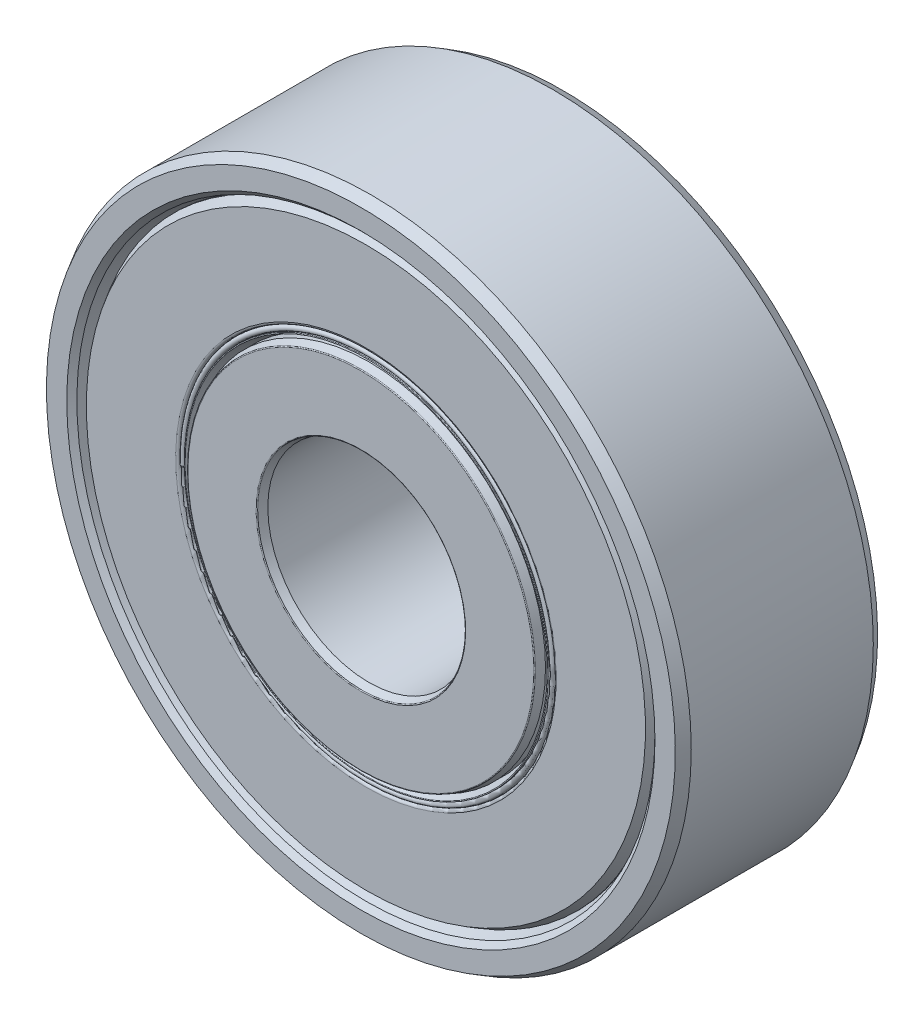
from build123d import *

# Parameters (mm, degrees)
CIRPATTERN1_COUNT = 6


with BuildPart() as part:
    # Sketch3 → Revolve1 (revolve)
    with BuildSketch(Plane(origin=(0, 0, 0), x_dir=(0, 0, -1), z_dir=(1, 0, 0)), mode=Mode.PRIVATE) as revolve1_sk:
        with BuildLine():
            Line((-2.524480927, 8.455), (-2.85, 8.573479253))
            Line((-2.85, 8.573479253), (-3, 8.723479253))
            Line((-3, 8.723479253), (-3, 9.326794919))
            Line((-3, 9.326794919), (-2.7, 9.5))
            Line((-2.7, 9.5), (2.7, 9.5))
            Line((2.7, 9.5), (3, 9.326794919))
            Line((3, 9.326794919), (3, 8.723479253))
            Line((3, 8.723479253), (2.85, 8.573479253))
            Line((2.85, 8.573479253), (2.524480927, 8.455))
            Line((2.524480927, 8.455), (1.398, 8.455))
            ThreePointArc((1.398, 8.455), (0, 8.9775), (-1.398, 8.455))
            Line((-1.398, 8.455), (-2.524480927, 8.455))
        make_face()
    revolve(revolve1_sk.sketch.rotate(Axis((0, 0, 3), (0, 0, -1)), 180), axis=Axis((0, 0, 3), (0, 0, -1)))


with BuildPart() as body_2:
    # Sketch4 → Revolve2 (revolve)
    with BuildSketch(Plane(origin=(0, 0, 0), x_dir=(0, 0, -1), z_dir=(1, 0, 0)), mode=Mode.PRIVATE) as revolve2_sk:
        with BuildLine():
            Line((-2.76, 3), (-2.980260604, 3.080168304))
            ThreePointArc((-2.980260604, 3.080168304), (-2.994574561, 3.091151789), (-3, 3.108359082))
            Line((-3, 3.108359082), (-3, 5.128654793))
            ThreePointArc((-3, 5.128654793), (-2.994574561, 5.145862086), (-2.980260604, 5.156845572))
            Line((-2.980260604, 5.156845572), (-2.76, 5.237013876))
            Line((-2.76, 5.237013876), (-1.398, 5.237013876))
            ThreePointArc((-1.398, 5.237013876), (0, 4.714513876), (1.398, 5.237013876))
            Line((1.398, 5.237013876), (2.76, 5.237013876))
            Line((2.76, 5.237013876), (2.980260604, 5.156845572))
            ThreePointArc((2.980260604, 5.156845572), (2.994574561, 5.145862086), (3, 5.128654793))
            Line((3, 5.128654793), (3, 3.108359082))
            ThreePointArc((3, 3.108359082), (2.994574561, 3.091151789), (2.980260604, 3.080168304))
            Line((2.980260604, 3.080168304), (2.76, 3))
            Line((2.76, 3), (-2.76, 3))
        make_face()
    revolve(revolve2_sk.sketch.rotate(Axis((0, 0, 3), (0, 0, -1)), 180), axis=Axis((0, 0, 3), (0, 0, -1)))


with BuildPart() as body_3:
    # Sketch5 → Revolve3 (revolve)
    with BuildSketch(Plane(origin=(0, 0, 0), x_dir=(0, 0, -1), z_dir=(1, 0, 0))):
        with BuildLine():
            Line((-2.131493062, 6.846006938), (2.131493062, 6.846006938))
            ThreePointArc((2.131493062, 6.846006938), (0, 8.9775), (-2.131493062, 6.846006938))
        make_face()
    revolve(axis=Axis((0, 6.846006938, 2.131493062), (0, 0, -1)))


with BuildPart() as cirpattern1_1:
    # CirPattern1: pattern copy
    add(body_3.part.rotate(Axis((0, 0, 0), (0, 0, 1)), 1 * 360 / CIRPATTERN1_COUNT))


with BuildPart() as cirpattern1_2:
    # CirPattern1: pattern copy
    add(body_3.part.rotate(Axis((0, 0, 0), (0, 0, 1)), 2 * 360 / CIRPATTERN1_COUNT))


with BuildPart() as cirpattern1_3:
    # CirPattern1: pattern copy
    add(body_3.part.rotate(Axis((0, 0, 0), (0, 0, 1)), 3 * 360 / CIRPATTERN1_COUNT))


with BuildPart() as cirpattern1_4:
    # CirPattern1: pattern copy
    add(body_3.part.rotate(Axis((0, 0, 0), (0, 0, 1)), 4 * 360 / CIRPATTERN1_COUNT))


with BuildPart() as cirpattern1_5:
    # CirPattern1: pattern copy
    add(body_3.part.rotate(Axis((0, 0, 0), (0, 0, 1)), 5 * 360 / CIRPATTERN1_COUNT))


with BuildPart() as body_9:
    # Sketch6 → Revolve4 (revolve)
    with BuildSketch(Plane(origin=(0, 0, 0), x_dir=(0, 0, -1), z_dir=(1, 0, 0)), mode=Mode.PRIVATE) as revolve4_sk:
        with BuildLine():
            Line((-2.568541744, 8.455), (-2.131493062, 8.455))
            Line((-2.131493062, 8.455), (-2.131493062, 5.562013876))
            Line((-2.131493062, 5.562013876), (-2.76875, 5.562013876))
            ThreePointArc((-2.76875, 5.562013876), (-2.826202426, 5.58581145), (-2.85, 5.643263876))
            Line((-2.85, 5.643263876), (-2.85, 8.2925))
            Line((-2.85, 8.2925), (-2.568541744, 8.455))
        make_face()
        with BuildLine():
            Line((2.76875, 5.562013876), (2.131493062, 5.562013876))
            Line((2.131493062, 5.562013876), (2.131493062, 8.455))
            Line((2.131493062, 8.455), (2.568541744, 8.455))
            Line((2.568541744, 8.455), (2.85, 8.2925))
            Line((2.85, 8.2925), (2.85, 5.643263876))
            ThreePointArc((2.85, 5.643263876), (2.826202426, 5.58581145), (2.76875, 5.562013876))
        make_face()
    revolve(revolve4_sk.sketch.rotate(Axis((0, 0, 3), (0, 0, -1)), 180), axis=Axis((0, 0, 3), (0, 0, -1)))


with BuildPart() as body_10:
    # Sketch7 → Revolve5 (revolve)
    with BuildSketch(Plane(origin=(0, 0, 0), x_dir=(0, 0, -1), z_dir=(1, 0, 0)), mode=Mode.PRIVATE) as revolve5_sk:
        with BuildLine():
            Line((-2.131493062, 5.237013876), (-2.473604147, 5.237013876))
            Line((-2.473604147, 5.237013876), (-2.840130302, 5.370418486))
            ThreePointArc((-2.840130302, 5.370418486), (-2.849772116, 5.387118598), (-2.835, 5.399513876))
            Line((-2.835, 5.399513876), (-2.76875, 5.399513876))
            ThreePointArc((-2.76875, 5.399513876), (-2.85, 5.480763876), (-2.76875, 5.562013876))
            Line((-2.76875, 5.562013876), (-2.131493062, 5.562013876))
            Line((-2.131493062, 5.562013876), (-2.131493062, 5.237013876))
        make_face()
        with BuildLine():
            Line((2.131493062, 5.562013876), (2.131493062, 5.237013876))
            Line((2.131493062, 5.237013876), (2.473604147, 5.237013876))
            Line((2.473604147, 5.237013876), (2.840130302, 5.370418486))
            ThreePointArc((2.840130302, 5.370418486), (2.849772116, 5.387118598), (2.835, 5.399513876))
            Line((2.835, 5.399513876), (2.76875, 5.399513876))
            ThreePointArc((2.76875, 5.399513876), (2.85, 5.480763876), (2.76875, 5.562013876))
            Line((2.76875, 5.562013876), (2.131493062, 5.562013876))
        make_face()
    revolve(revolve5_sk.sketch.rotate(Axis((0, 0, 3), (0, 0, -1)), 180), axis=Axis((0, 0, 3), (0, 0, -1)))


solid = Compound([part.part, body_2.part, body_3.part, cirpattern1_1.part, cirpattern1_2.part, cirpattern1_3.part, cirpattern1_4.part, cirpattern1_5.part, body_9.part, body_10.part])
